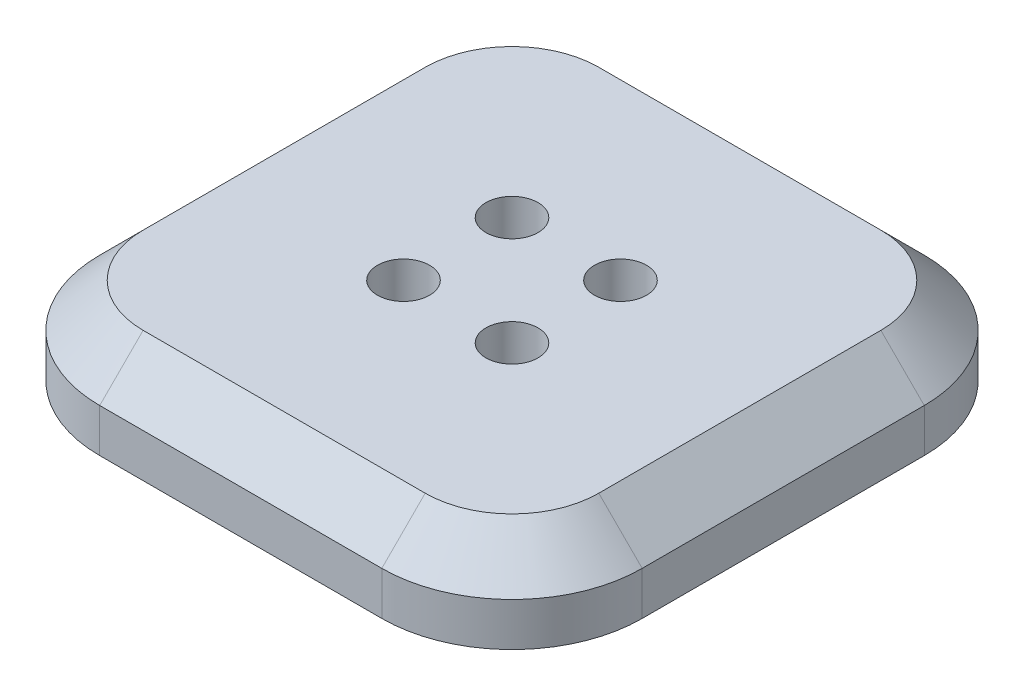
from build123d import *

# Parameters (mm, degrees)
CROQUIS1_W              = 125
CROQUIS1_H              = 125
SALIENTE_EXTRUIR1_DEPTH = 20
REDONDEO1_R             = 30
CHAFL_N1_SIZE           = 10
TALADRO3_D              = 12
TALADRO3_DEPTH          = 10
TALADRO3_TIP            = 3.605163714
TALADRO5_D              = 12
TALADRO5_DEPTH          = 10
TALADRO5_TIP            = 3.605163714


with BuildPart() as part:
    # Croquis1 → Saliente-Extruir1 (new body)
    with BuildSketch(Plane(origin=(0, 0, 0), x_dir=(1, 0, 0), z_dir=(0, 1, 0))):
        Rectangle(CROQUIS1_W, CROQUIS1_H)
    extrude(amount=SALIENTE_EXTRUIR1_DEPTH)

    # Redondeo1
    redondeo1_edges = [part.edges().sort_by_distance(p)[0] for p in [
        (62.5, 10, 62.5),
        (-62.5, 10, 62.5),
        (-62.5, 10, -62.5),
        (62.5, 10, -62.5),
    ]]
    fillet(redondeo1_edges, radius=REDONDEO1_R)

    # Chaflán1
    chafl_n1_edges = [part.edges().sort_by_distance(p)[0] for p in [
        (-62.5, 20, 0),
        (0, 20, -62.5),
        (62.5, 20, 0),
        (0, 20, 62.5),
        (53.713203436, 20, 53.713203436),
        (53.713203436, 20, -53.713203436),
        (-53.713203436, 20, 53.713203436),
        (-53.713203436, 20, -53.713203436),
    ]]
    chamfer(chafl_n1_edges, length=CHAFL_N1_SIZE)

    # Taladro3
    with Locations(Plane(origin=(0, 0, 0), x_dir=(-1, 0, 0), z_dir=(0, -1, 0))):
        with Locations((-37.5, 37.5), (37.5, 37.5), (37.5, -37.5), (-37.5, -37.5)):
            Hole(TALADRO3_D / 2, depth=TALADRO3_DEPTH)
            with Locations((0, 0, -(TALADRO3_DEPTH + TALADRO3_TIP / 2))):  # 118° drill point
                Cone(0, TALADRO3_D / 2, TALADRO3_TIP, mode=Mode.SUBTRACT)

    # Taladro5
    with Locations(Plane(origin=(0, 20, 0), x_dir=(1, 0, 0), z_dir=(0, 1, 0))):
        with Locations((-12.5, 12.5), (12.5, 12.5), (12.5, -12.5), (-12.5, -12.5)):
            Hole(TALADRO5_D / 2, depth=TALADRO5_DEPTH)
            with Locations((0, 0, -(TALADRO5_DEPTH + TALADRO5_TIP / 2))):  # 118° drill point
                Cone(0, TALADRO5_D / 2, TALADRO5_TIP, mode=Mode.SUBTRACT)


solid = part.part
